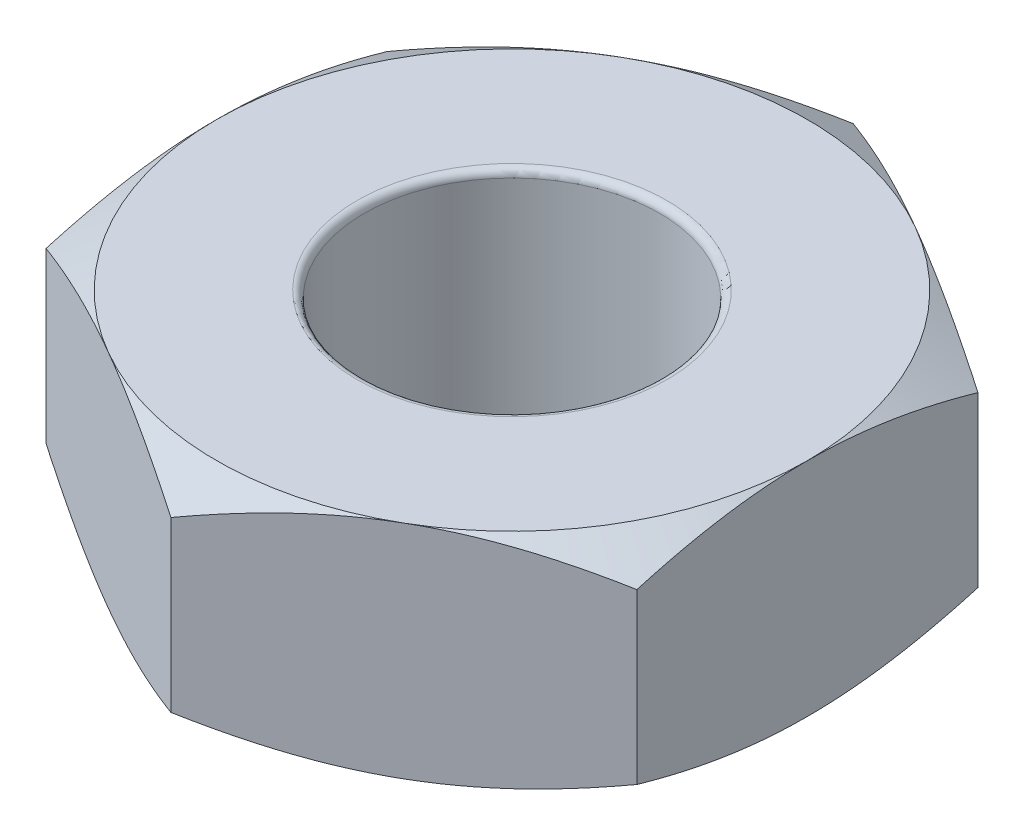
from build123d import *

# Parameters (mm, degrees)
SKETCH1_R           = 1
BOSS_EXTRUDE1_DEPTH = 1.5
SKETCH2_OUTSIDE_W   = 14.186
SKETCH2_OUTSIDE_H   = 14.804
SKETCH2_OUTSIDE_R   = 2
CUT_EXTRUDE1_DEPTH  = 2
CUT_EXTRUDE1_DRAFT  = -60
SKETCH3_OUTSIDE_W   = 14.186
SKETCH3_OUTSIDE_H   = 14.804
SKETCH3_OUTSIDE_R   = 2
CUT_EXTRUDE2_DEPTH  = 2
CUT_EXTRUDE2_DRAFT  = -60
FILLET1_R           = 0.05


with BuildPart() as part:
    # Sketch1 → Boss-Extrude1 (new body)
    with BuildSketch(Plane(origin=(0, 0, 0), x_dir=(1, 0, 0), z_dir=(0, 1, 0))):
        Polygon((0, 2.309401077), (-2, 1.154700538), (-2, -1.154700538), (0, -2.309401077), (2, -1.154700538), (2, 1.154700538), align=None)
        with Locations(Location((0, 0, 0), (0, 0, 270))):
            Circle(SKETCH1_R, mode=Mode.SUBTRACT)
    extrude(amount=BOSS_EXTRUDE1_DEPTH)


with BuildPart() as cut_extrude1_tool:
    # Sketch2 outside → Cut-Extrude1 (with draft: the straight prism first)
    with BuildSketch(Plane(origin=(0, 1.5, 0), x_dir=(1, 0, 0), z_dir=(0, 1, 0))):
        Rectangle(SKETCH2_OUTSIDE_W, SKETCH2_OUTSIDE_H)
        Circle(SKETCH2_OUTSIDE_R, mode=Mode.SUBTRACT)
    extrude(amount=-CUT_EXTRUDE1_DEPTH)
    # Cut-Extrude1: the draft: its side faces are tilted about the plane it starts from
    cut_extrude1_sides = [cut_extrude1_tool.faces().sort_by_distance(p)[0] for p in [
        (0, 0.5, 7.402),
        (7.093, 0.5, 0),
        (0, 0.5, -7.402),
        (-7.093, 0.5, 0),
        (-2, 0.5, 0),
    ]]
    draft(cut_extrude1_sides, Plane(origin=(0, 1.5, 0), x_dir=(1, 0, 0), z_dir=(0, 1, 0)), CUT_EXTRUDE1_DRAFT)


with BuildPart() as part_1:
    add(part.part)

    # Cut-Extrude1: cut by cut_extrude1_tool
    add(cut_extrude1_tool.part, mode=Mode.SUBTRACT)


with BuildPart() as cut_extrude2_tool:
    # Sketch3 outside → Cut-Extrude2 (with draft: the straight prism first)
    with BuildSketch(Plane.XZ):
        Rectangle(SKETCH3_OUTSIDE_W, SKETCH3_OUTSIDE_H)
        Circle(SKETCH3_OUTSIDE_R, mode=Mode.SUBTRACT)
    extrude(amount=-CUT_EXTRUDE2_DEPTH)
    # Cut-Extrude2: the draft: its side faces are tilted about the plane it starts from
    cut_extrude2_sides = [cut_extrude2_tool.faces().sort_by_distance(p)[0] for p in [
        (0, 1, -7.402),
        (7.093, 1, 0),
        (0, 1, 7.402),
        (-7.093, 1, 0),
        (-2, 1, 0),
    ]]
    draft(cut_extrude2_sides, Plane.XZ, CUT_EXTRUDE2_DRAFT)


with BuildPart() as part_2:
    add(part_1.part)

    # Cut-Extrude2: cut by cut_extrude2_tool
    add(cut_extrude2_tool.part, mode=Mode.SUBTRACT)

    # Fillet1
    fillet1_edges = [part_2.edges().sort_by_distance(p)[0] for p in [
        (0, 0, -1),
        (0, 1.5, -1),
    ]]
    fillet(fillet1_edges, radius=FILLET1_R)


solid = part_2.part
